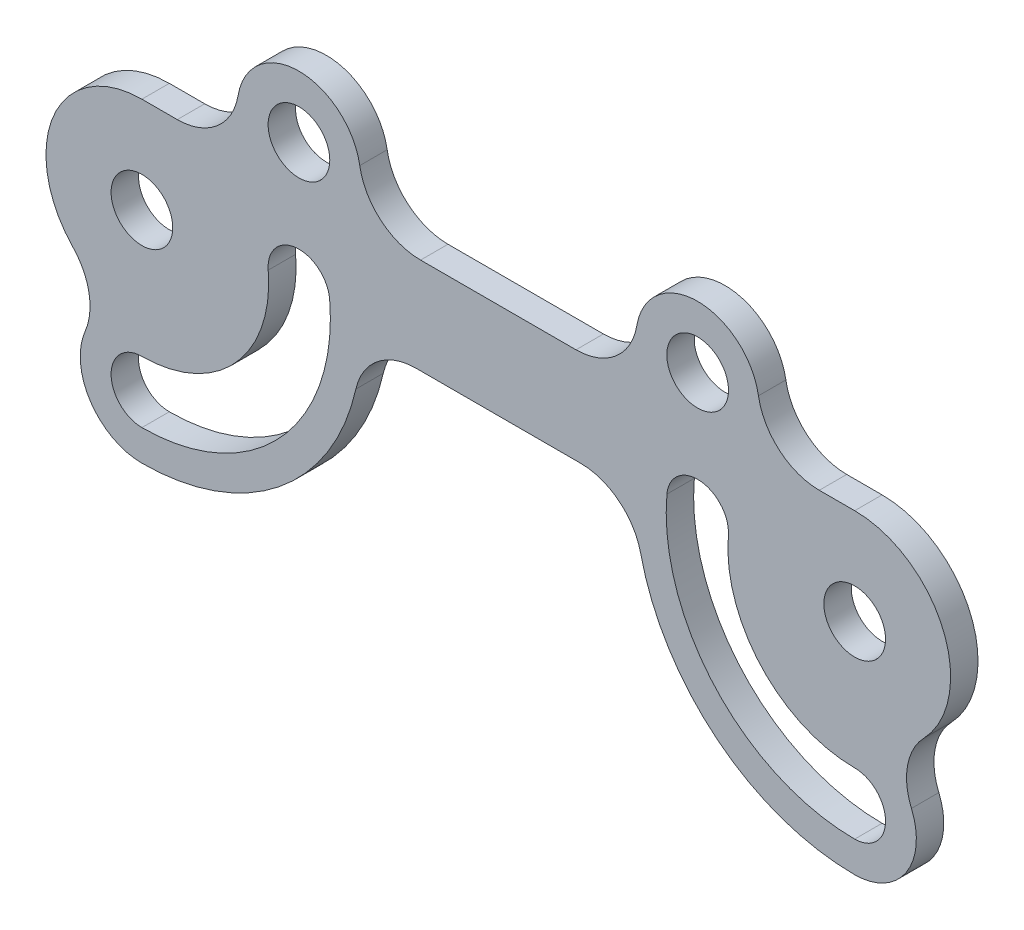
from build123d import *

# Parameters (mm, degrees)
SKETCH1_R           = 1.7859375
BOSS_EXTRUDE1_DEPTH = 1.5875
FILLET1_R           = 3.571875


with BuildPart() as part:
    # Sketch1 → Boss-Extrude1 (new body)
    with BuildSketch(Plane.XY):
        with BuildLine():
            ThreePointArc((41.275, -12.7), (44.846875, -9.128125), (41.275, -5.55625))
            ThreePointArc((41.275, -5.55625), (46.83125, 0), (41.275, 5.55625))
            Line((41.275, 5.55625), (34.84230106, 5.55625))
            ThreePointArc((34.84230106, 5.55625), (32.181610271, 11.511193514), (29.520919483, 5.55625))
            Line((29.520919483, 5.55625), (11.754080517, 5.55625))
            ThreePointArc((11.754080517, 5.55625), (9.093389729, 11.511193514), (6.43269894, 5.55625))
            Line((6.43269894, 5.55625), (0, 5.55625))
            ThreePointArc((0, 5.55625), (-5.55625, 0), (0, -5.55625))
            ThreePointArc((0, -5.55625), (-3.571875, -9.128125), (0, -12.7))
            ThreePointArc((0, -12.7), (8.980256121, -8.980256121), (12.7, 0))
            Line((12.7, 0), (28.575, 0))
            ThreePointArc((28.575, 0), (32.294743879, -8.980256121), (41.275, -12.7))
        make_face()
        with BuildLine():
            ThreePointArc((0, -10.9140625), (-1.7859375, -9.128125), (0, -7.3421875))
            ThreePointArc((0, -7.3421875), (5.413228446, -4.960309977), (7.31424826, 0.639913805))
            ThreePointArc((7.31424826, 0.639913805), (8.937735019, 2.574709983), (10.872531197, 0.951223224))
            ThreePointArc((10.872531197, 0.951223224), (8.046690934, -7.37343375), (0, -10.9140625))
        make_face(mode=Mode.SUBTRACT)
        with BuildLine():
            ThreePointArc((33.96075174, 0.639913805), (35.861771554, -4.960309977), (41.275, -7.3421875))
            ThreePointArc((41.275, -7.3421875), (43.0609375, -9.128125), (41.275, -10.9140625))
            ThreePointArc((41.275, -10.9140625), (33.228309066, -7.37343375), (30.402468803, 0.951223224))
            ThreePointArc((30.402468803, 0.951223224), (32.337264981, 2.574709983), (33.96075174, 0.639913805))
        make_face(mode=Mode.SUBTRACT)
        Circle(SKETCH1_R, mode=Mode.SUBTRACT)
        with Locations((9.093389729, 7.939318514)):
            Circle(SKETCH1_R, mode=Mode.SUBTRACT)
        with Locations((41.275, 0)):
            Circle(SKETCH1_R, mode=Mode.SUBTRACT)
        with Locations((32.181610271, 7.939318514)):
            Circle(SKETCH1_R, mode=Mode.SUBTRACT)
    extrude(amount=BOSS_EXTRUDE1_DEPTH)

    # Fillet1
    fillet1_edges = [part.edges().sort_by_distance(p)[0] for p in [
        (6.43269894, 5.55625, 0.79375),
        (11.754080517, 5.55625, 0.79375),
        (29.520919483, 5.55625, 0.79375),
        (34.84230106, 5.55625, 0.79375),
        (41.275, -5.55625, 0.79375),
        (28.575, 0, 0.79375),
        (12.7, 0, 0.79375),
        (0, -5.55625, 0.79375),
    ]]
    fillet(fillet1_edges, radius=FILLET1_R)


solid = part.part
